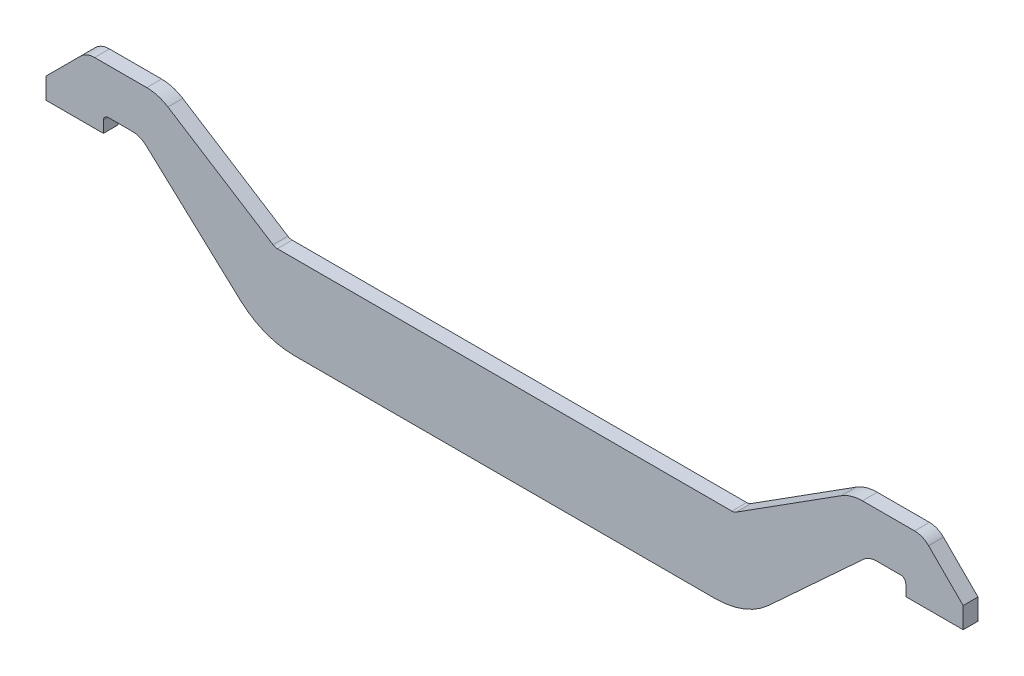
from build123d import *

# Parameters (mm, degrees)
BOSS_EXTRUDE1_DEPTH = 4.7625
F_1_0_RADIUS_R      = 25.4
F_0_1_RADIUS_R      = 2.54
F_0_25_RADIUS_R     = 6.35
F_0_5_RADIUS_R      = 12.7
F_0_0625_RADIUS_R   = 1.5875


with BuildPart() as part:
    # Sketch1 → Boss-Extrude1 (new body)
    with BuildSketch(Plane.XY):
        Polygon((0, 0), (154.94, 0), (194.3735, 36.322), (206.1845, 36.322), (206.1845, 31.115), (224.5995, 31.115), (224.5995, 37.846), (211.6455, 50.8), (188.595, 50.8), (151.13, 26.9875), (3.81, 26.9875), (-33.655, 50.8), (-56.7055, 50.8), (-69.6595, 37.846), (-69.6595, 36.322), (-69.6595, 31.115), (-51.2445, 31.115), (-51.2445, 36.322), (-39.4335, 36.322), align=None)
    extrude(amount=BOSS_EXTRUDE1_DEPTH)

    # 1.0 Radius
    f_1_0_radius_edges = [part.edges().sort_by_distance(p)[0] for p in [
        (154.94, 0, 2.38125),
        (0, 0, 2.38125),
    ]]
    fillet(f_1_0_radius_edges, radius=F_1_0_RADIUS_R)

    # 0.1 Radius
    f_0_1_radius_edges = [part.edges().sort_by_distance(p)[0] for p in [
        (3.81, 26.9875, 2.38125),
        (151.13, 26.9875, 2.38125),
    ]]
    fillet(f_0_1_radius_edges, radius=F_0_1_RADIUS_R)

    # 0.25 Radius
    f_0_25_radius_edges = [part.edges().sort_by_distance(p)[0] for p in [
        (211.6455, 50.8, 2.38125),
        (194.3735, 36.322, 2.38125),
        (-39.4335, 36.322, 2.38125),
        (-56.7055, 50.8, 2.38125),
    ]]
    fillet(f_0_25_radius_edges, radius=F_0_25_RADIUS_R)

    # 0.5 Radius
    f_0_5_radius_edges = [part.edges().sort_by_distance(p)[0] for p in [
        (188.595, 50.8, 2.38125),
        (-33.655, 50.8, 2.38125),
    ]]
    fillet(f_0_5_radius_edges, radius=F_0_5_RADIUS_R)

    # 0.0625 Radius
    f_0_0625_radius_edges = [part.edges().sort_by_distance(p)[0] for p in [
        (206.1845, 36.322, 2.38125),
        (-51.2445, 36.322, 2.38125),
    ]]
    fillet(f_0_0625_radius_edges, radius=F_0_0625_RADIUS_R)


solid = part.part
